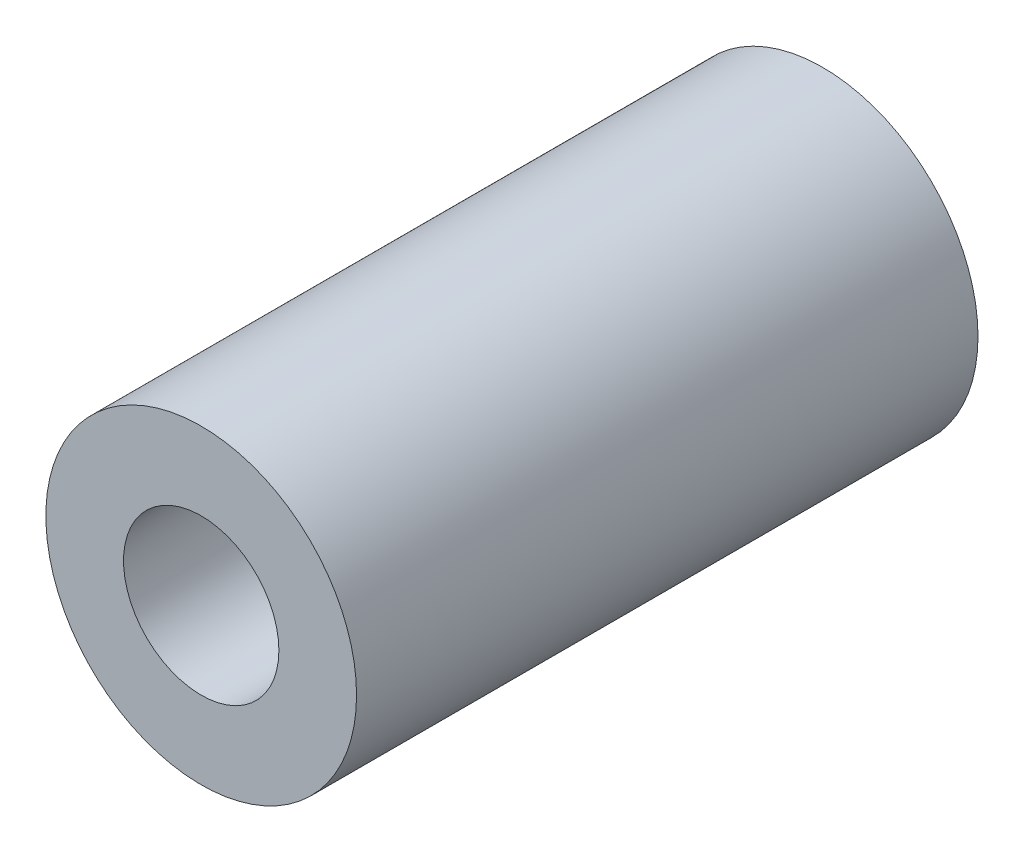
from build123d import *

# Parameters (mm, degrees)
SKETCH1_R           = 6.35
SKETCH1_R_2         = 3.175
BOSS_EXTRUDE1_DEPTH = 25.4


with BuildPart() as part:
    # Sketch1 → Boss-Extrude1 (new body)
    with BuildSketch(Plane.XY):
        Circle(SKETCH1_R)
        Circle(SKETCH1_R_2, mode=Mode.SUBTRACT)
    extrude(amount=BOSS_EXTRUDE1_DEPTH)


solid = part.part
